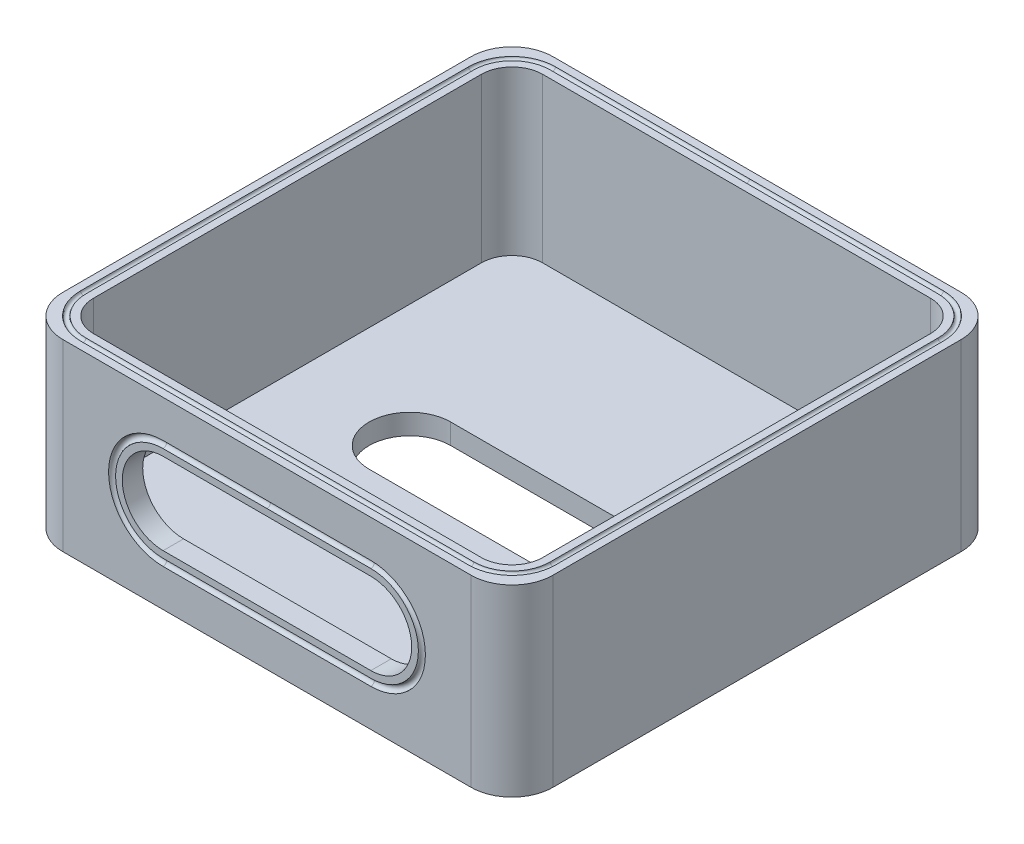
from build123d import *

# Parameters (mm, degrees)
SKETCH1_W           = 304.8
SKETCH1_H           = 304.8
BOSS_EXTRUDE1_DEPTH = 114.3
SHELL1_T            = -12.7
CUT_EXTRUDE1_DEPTH  = 21.51
SKETCH10_R          = 2.1844
CUT_EXTRUDE5_DEPTH  = 244.959033446
SKETCH16_R          = 1.651
SKETCH17_R          = 2.5527
CUT_EXTRUDE6_DEPTH  = 6.35
FILLET2_R           = 19.05
SKETCH21_R          = 1.651
FILLET3_R           = 25.4


with BuildPart() as part:
    # Sketch1 → Boss-Extrude1 (new body)
    with BuildSketch(Plane(origin=(0, 0, 0), x_dir=(1, 0, 0), z_dir=(0, 1, 0))):
        Rectangle(SKETCH1_W, SKETCH1_H)
    extrude(amount=BOSS_EXTRUDE1_DEPTH)

    # Shell1
    shell1_openings = [part.faces().sort_by_distance(p)[0] for p in [
        (0, 114.3, 0),
    ]]
    offset(amount=SHELL1_T, openings=shell1_openings, kind=Kind.INTERSECTION)

    # Sketch2 → Cut-Extrude1 (cut, symmetric)
    with BuildSketch(Plane.XY.offset(152.4)):
        with BuildLine():
            Line((-64.6, 82.55), (64.6, 82.55))
            ThreePointArc((64.6, 82.55), (90, 57.15), (64.6, 31.75))
            Line((64.6, 31.75), (-64.6, 31.75))
            ThreePointArc((-64.6, 31.75), (-90, 57.15), (-64.6, 82.55))
        make_face()
    extrude(amount=CUT_EXTRUDE1_DEPTH, both=True, mode=Mode.SUBTRACT)

    # Cut-Sweep1: sweep along a path in Sketch9
    with BuildLine(Plane.XY.offset(152.4)) as cut_sweep1_path:
        Line((64.6, 88.9), (-64.6, 88.9))
        ThreePointArc((-64.6, 88.9), (-96.35, 57.15), (-64.6, 25.4))
        Line((-64.6, 25.4), (64.6, 25.4))
        ThreePointArc((64.6, 25.4), (96.35, 57.15), (64.6, 88.9))
    # Sketch10 → Cut-Sweep1 (sweep, cut)
    with BuildSketch(Plane(origin=(0, 0, 0), x_dir=(0, 0, -1), z_dir=(1, 0, 0))):
        with Locations((-152.4, 88.9)):
            Circle(SKETCH10_R)
    sweep(path=cut_sweep1_path.line, mode=Mode.SUBTRACT)

    # Sketch13 → Cut-Extrude5 (cut, through all)
    with BuildSketch(Plane.XZ):
        with BuildLine():
            Line((-63.5, -25.4), (63.5, -25.4))
            ThreePointArc((63.5, -25.4), (88.9, 0), (63.5, 25.4))
            Line((63.5, 25.4), (-63.5, 25.4))
            ThreePointArc((-63.5, 25.4), (-88.9, 0), (-63.5, -25.4))
        make_face()
    extrude(amount=-CUT_EXTRUDE5_DEPTH, mode=Mode.SUBTRACT)

    # Cut-Sweep2: sweep along a path in Sketch14
    with BuildLine(Plane.XZ) as cut_sweep2_path:
        Line((63.5, 33.02), (-63.5, 33.02))
        ThreePointArc((-63.5, 33.02), (-96.52, 0), (-63.5, -33.02))
        Line((-63.5, -33.02), (63.5, -33.02))
        ThreePointArc((63.5, -33.02), (96.52, 0), (63.5, 33.02))
    # Sketch16 → Cut-Sweep2 (sweep, cut)
    with BuildSketch(Plane(origin=(0, 0, 0), x_dir=(0, 0, -1), z_dir=(1, 0, 0))):
        with Locations((33.02, 0)):
            Circle(SKETCH16_R)
    sweep(path=cut_sweep2_path.line, mode=Mode.SUBTRACT)

    # Sketch17 → Cut-Extrude6 (cut)
    with BuildSketch(Plane.XZ):
        with Locations(Location((63.5, 40.259, 0), (0, 0, 270))):
            Circle(SKETCH17_R)
        with Locations(Location((38.1, 40.259, 0), (0, 0, 270))):
            Circle(SKETCH17_R)
        with Locations(Location((12.7, 40.259, 0), (0, 0, 270))):
            Circle(SKETCH17_R)
        with Locations(Location((-12.7, 40.259, 0), (0, 0, 270))):
            Circle(SKETCH17_R)
        with Locations(Location((-38.1, 40.259, 0), (0, 0, 270))):
            Circle(SKETCH17_R)
        with Locations(Location((-63.5, 40.259, 0), (0, 0, 270))):
            Circle(SKETCH17_R)
        with Locations(Location((83.6295, 34.865316731, 0), (0, 0, 270))):
            Circle(SKETCH17_R)
        with Locations(Location((98.365316731, 20.1295, 0), (0, 0, 270))):
            Circle(SKETCH17_R)
        with Locations(Location((103.759, 0, 0), (0, 0, 270))):
            Circle(SKETCH17_R)
        with Locations(Location((-103.759, 0, 0), (0, 0, 90))):
            Circle(SKETCH17_R)
        with Locations(Location((-98.365316731, 20.1295, 0), (0, 0, 90))):
            Circle(SKETCH17_R)
        with Locations(Location((-83.6295, 34.865316731, 0), (0, 0, 90))):
            Circle(SKETCH17_R)
        with Locations(Location((98.365316731, -20.1295, 0), (0, 0, 90))):
            Circle(SKETCH17_R)
        with Locations(Location((83.6295, -34.865316731, 0), (0, 0, 90))):
            Circle(SKETCH17_R)
        with Locations(Location((63.5, -40.259, 0), (0, 0, 90))):
            Circle(SKETCH17_R)
        with Locations(Location((38.1, -40.259, 0), (0, 0, 90))):
            Circle(SKETCH17_R)
        with Locations(Location((12.7, -40.259, 0), (0, 0, 90))):
            Circle(SKETCH17_R)
        with Locations(Location((-12.7, -40.259, 0), (0, 0, 90))):
            Circle(SKETCH17_R)
        with Locations(Location((-38.1, -40.259, 0), (0, 0, 90))):
            Circle(SKETCH17_R)
        with Locations(Location((-63.5, -40.259, 0), (0, 0, 90))):
            Circle(SKETCH17_R)
        with Locations(Location((-83.6295, -34.865316731, 0), (0, 0, 270))):
            Circle(SKETCH17_R)
        with Locations(Location((-98.365316731, -20.1295, 0), (0, 0, 270))):
            Circle(SKETCH17_R)
    extrude(amount=-CUT_EXTRUDE6_DEPTH, mode=Mode.SUBTRACT)

    # Fillet2
    fillet2_edges = [part.edges().sort_by_distance(p)[0] for p in [
        (-139.7, 63.5, 139.7),
        (139.7, 63.5, 139.7),
        (139.7, 63.5, -139.7),
        (-139.7, 63.5, -139.7),
    ]]
    fillet(fillet2_edges, radius=FILLET2_R)

    # Cut-Sweep4: sweep along a path in Sketch20
    with BuildLine(Plane(origin=(0, 114.3, 0), x_dir=(1, 0, 0), z_dir=(0, 1, 0))) as cut_sweep4_path:
        Line((-120.65, -146.05), (120.65, -146.05))
        ThreePointArc((120.65, -146.05), (138.610512242, -138.610512242), (146.05, -120.65))
        Line((146.05, -120.65), (146.05, 120.65))
        ThreePointArc((146.05, 120.65), (138.610512242, 138.610512242), (120.65, 146.05))
        Line((120.65, 146.05), (-120.65, 146.05))
        ThreePointArc((-120.65, 146.05), (-138.610512242, 138.610512242), (-146.05, 120.65))
        Line((-146.05, 120.65), (-146.05, -120.65))
        ThreePointArc((-146.05, -120.65), (-138.610512242, -138.610512242), (-120.65, -146.05))
    # Sketch21 → Cut-Sweep4 (sweep, cut)
    with BuildSketch(Plane(origin=(0, 0, 0), x_dir=(0, 0, -1), z_dir=(1, 0, 0))):
        with Locations((146.05, 114.3)):
            Circle(SKETCH21_R)
    sweep(path=cut_sweep4_path.line, mode=Mode.SUBTRACT)

    # Fillet3
    fillet3_edges = [part.edges().sort_by_distance(p)[0] for p in [
        (-152.4, 57.15, 152.4),
        (-152.4, 57.15, -152.4),
        (152.4, 57.15, -152.4),
        (152.4, 57.15, 152.4),
    ]]
    fillet(fillet3_edges, radius=FILLET3_R)


solid = part.part
